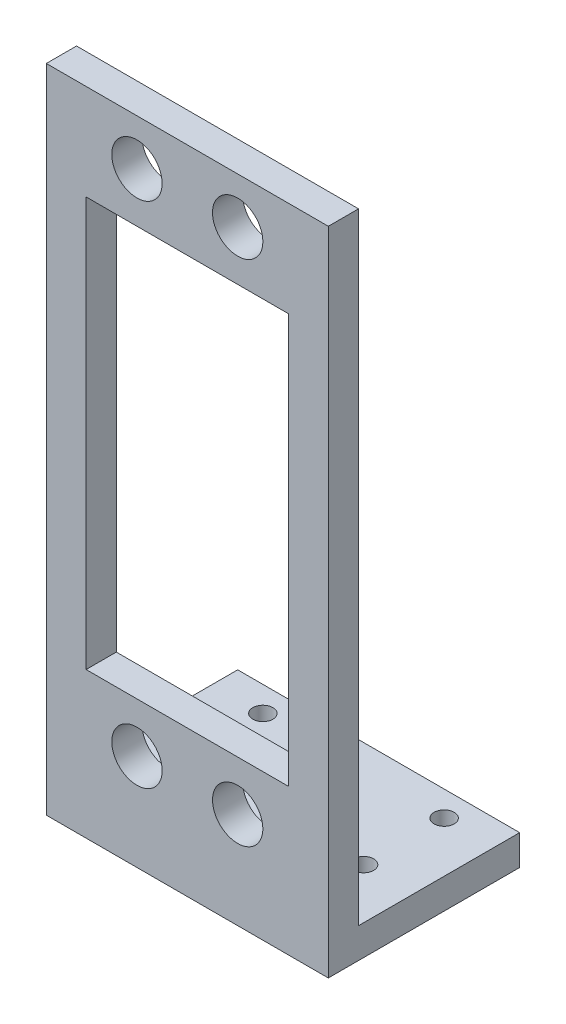
from build123d import *

# Parameters (mm, degrees)
SKETCH1_W           = 28
SKETCH1_H           = 64.64
BOSS_EXTRUDE1_DEPTH = 3
SKETCH2_R           = 2.5
CUT_EXTRUDE1_DEPTH  = 71.507656322
SKETCH4_W           = 20.1
SKETCH4_H           = 40.64
CUT_EXTRUDE6_DEPTH  = 10
SKETCH5_W           = 28
SKETCH5_H           = 3
BOSS_EXTRUDE2_DEPTH = 16
SKETCH6_R           = 1
CUT_EXTRUDE7_DEPTH  = 10


with BuildPart() as part:
    # Sketch1 → Boss-Extrude1 (new body)
    with BuildSketch(Plane.XY):
        with Locations((14, 32.32)):
            Rectangle(SKETCH1_W, SKETCH1_H)
    extrude(amount=BOSS_EXTRUDE1_DEPTH)

    # Sketch2 → Cut-Extrude1 (cut, through all)
    with BuildSketch(Plane.XY.offset(3)):
        with Locations((9, 9.57)):
            Circle(SKETCH2_R)
        with Locations((19, 9.57)):
            Circle(SKETCH2_R)
        with Locations((9, 60.07)):
            Circle(SKETCH2_R)
        with Locations((19, 60.07)):
            Circle(SKETCH2_R)
    extrude(amount=-CUT_EXTRUDE1_DEPTH, mode=Mode.SUBTRACT)

    # Sketch4 → Cut-Extrude6 (cut)
    with BuildSketch(Plane.XY.offset(3)):
        with Locations((14, 34.82)):
            Rectangle(SKETCH4_W, SKETCH4_H)
    extrude(amount=-CUT_EXTRUDE6_DEPTH, mode=Mode.SUBTRACT)

    # Sketch5 → Boss-Extrude2 (add)
    with BuildSketch(Plane(origin=(0, 0, 0), x_dir=(-1, 0, 0), z_dir=(0, 0, -1))):
        with Locations((-14, 1.5)):
            Rectangle(SKETCH5_W, SKETCH5_H)
    extrude(amount=BOSS_EXTRUDE2_DEPTH)

    # Sketch6 → Cut-Extrude7 (cut)
    with BuildSketch(Plane(origin=(0, 3, 0), x_dir=(1, 0, 0), z_dir=(0, 1, 0))):
        with Locations(Location((5, 5.5, 0), (0, 0, 180))):
            Circle(SKETCH6_R)
        with Locations(Location((5, 13.5, 0), (0, 0, 180))):
            Circle(SKETCH6_R)
        with Locations(Location((23, 13.5, 0), (0, 0, 180))):
            Circle(SKETCH6_R)
        with Locations(Location((23, 5.5, 0), (0, 0, 180))):
            Circle(SKETCH6_R)
    extrude(amount=-CUT_EXTRUDE7_DEPTH, mode=Mode.SUBTRACT)


solid = part.part
